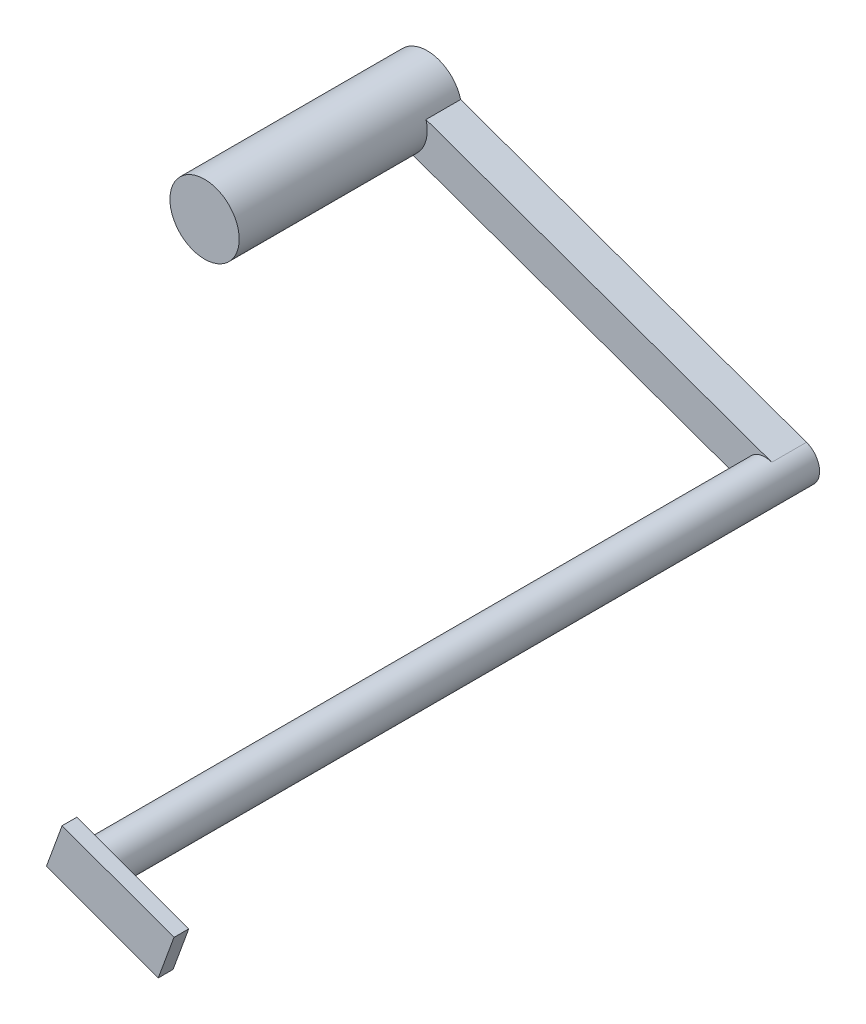
from build123d import *

# Parameters (mm, degrees)
SKETCH_1_R      = 7
EXTRUDE_1_DEPTH = 45
EXTRUDE_2_DEPTH = 7
SKETCH_7_R      = 4
EXTRUDE_3_DEPTH = 135
EXTRUDE_4_DEPTH = 3


with BuildPart() as part:
    # 草图1 → 凸台-拉伸1 (new body)
    with BuildSketch(Plane.XY):
        with Locations(Location((-86.606649797, -63.783530386, 0), (0, 0, 180))):
            Circle(SKETCH_1_R)
    extrude(amount=EXTRUDE_1_DEPTH)

    # 草图3 → 凸台-拉伸2 (add)
    with BuildSketch(Plane(origin=(0, 0, 0), x_dir=(-1, 0, 0), z_dir=(0, 0, -1))):
        with BuildLine():
            Line((87.955581339, -67.549215409), (12.641880873, -94.52784625))
            ThreePointArc((12.641880873, -94.52784625), (7.527264308, -92.111092769), (9.944017789, -86.996476204))
            Line((9.944017789, -86.996476204), (85.257718255, -60.017845362))
            ThreePointArc((85.257718255, -60.017845362), (90.37233482, -62.434598843), (87.955581339, -67.549215409))
        make_face()
    extrude(amount=-EXTRUDE_2_DEPTH)

    # 草图7 → 凸台-拉伸3 (add)
    with BuildSketch(Plane.XY.offset(7)):
        with Locations(Location((-11.292949331, -90.762161227, 0), (0, 0, 250.291624105))):
            Circle(SKETCH_7_R)
    extrude(amount=EXTRUDE_3_DEPTH)

    # 草图8 → 凸台-拉伸4 (add)
    with BuildSketch(Plane.XY.offset(142)):
        Polygon((-15.394140478, -84.335981352), (7.207577452, -92.593097239), (4.030932181, -101.288341605), (-18.57078575, -93.031225719), align=None)
    extrude(amount=EXTRUDE_4_DEPTH)


solid = part.part
